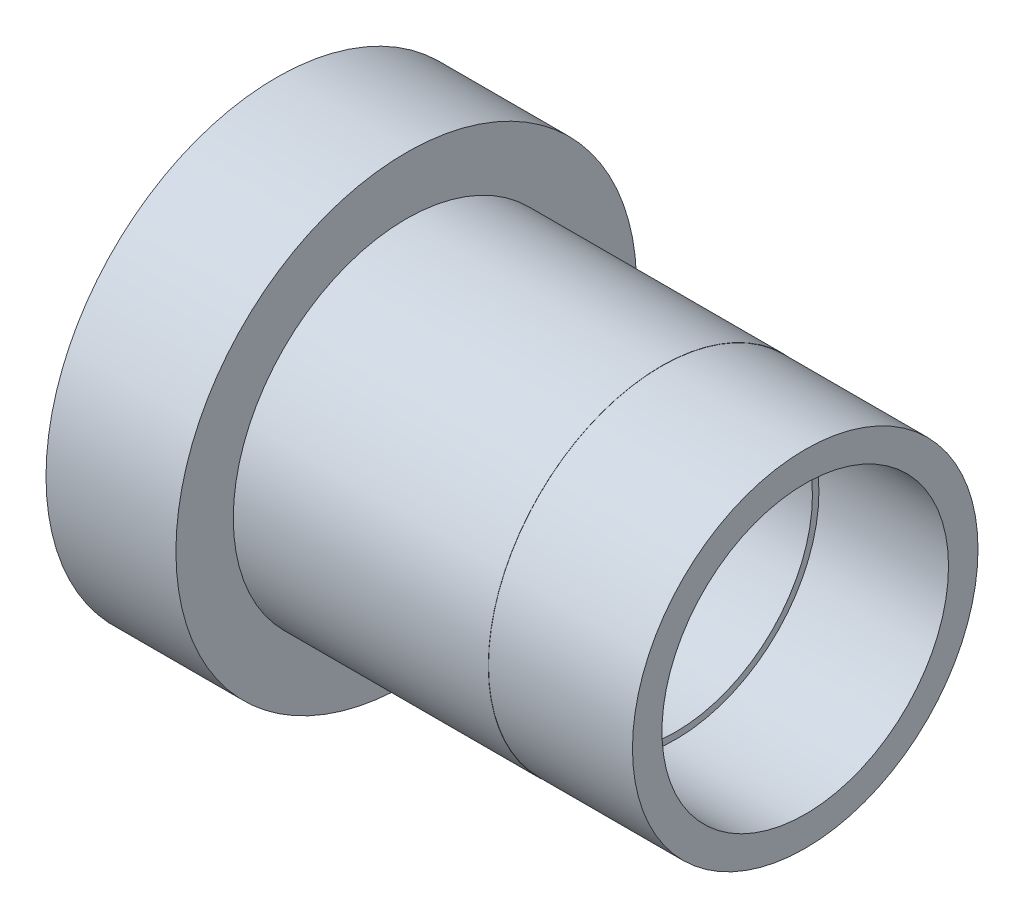
from build123d import *

# Parameters (mm, degrees)
SKETCH2_R          = 3.9497
CUT_EXTRUDE1_DEPTH = 3.571875
SKETCH3_R          = 3.7703125
CUT_EXTRUDE2_DEPTH = 18.123368131
CUT_EXTRUDE3_START = -3.571875
SKETCH4_R          = 3.9497
CUT_EXTRUDE3_DEPTH = 3.571875


with BuildPart() as part:
    # Sketch1 → Revolve1 (revolve)
    with BuildSketch(Plane.XY, mode=Mode.PRIVATE) as revolve1_sk:
        Polygon((0, 0), (0, 4.7625), (-3.96875, 4.7625), (-3.96875, 4.76885), (-10.9982, 4.76885), (-10.9982, 6.35), (-14.5796, 6.35), (-14.5796, 0), align=None)
    revolve(revolve1_sk.sketch.rotate(Axis((-14.5796, 0, 0), (1, 0, 0)), 90), axis=Axis((-14.5796, 0, 0), (1, 0, 0)))

    # Sketch2 → Cut-Extrude1 (cut)
    with BuildSketch(Plane(origin=(0, 0, 0), x_dir=(0, 0, -1), z_dir=(1, 0, 0))):
        Circle(SKETCH2_R)
    extrude(amount=-CUT_EXTRUDE1_DEPTH, mode=Mode.SUBTRACT)

    # Sketch3 → Cut-Extrude2 (cut, through all)
    with BuildSketch(Plane.ZY.offset(14.5796)):
        Circle(SKETCH3_R)
    extrude(amount=-CUT_EXTRUDE2_DEPTH, mode=Mode.SUBTRACT)

    # Sketch4 → Cut-Extrude3 (cut)
    with BuildSketch(Plane.ZY.offset(14.5796).offset(CUT_EXTRUDE3_START)):
        with Locations(Location((0, 0, 0), (0, 0, 180))):
            Circle(SKETCH4_R)
    extrude(amount=CUT_EXTRUDE3_DEPTH, mode=Mode.SUBTRACT)


solid = part.part
